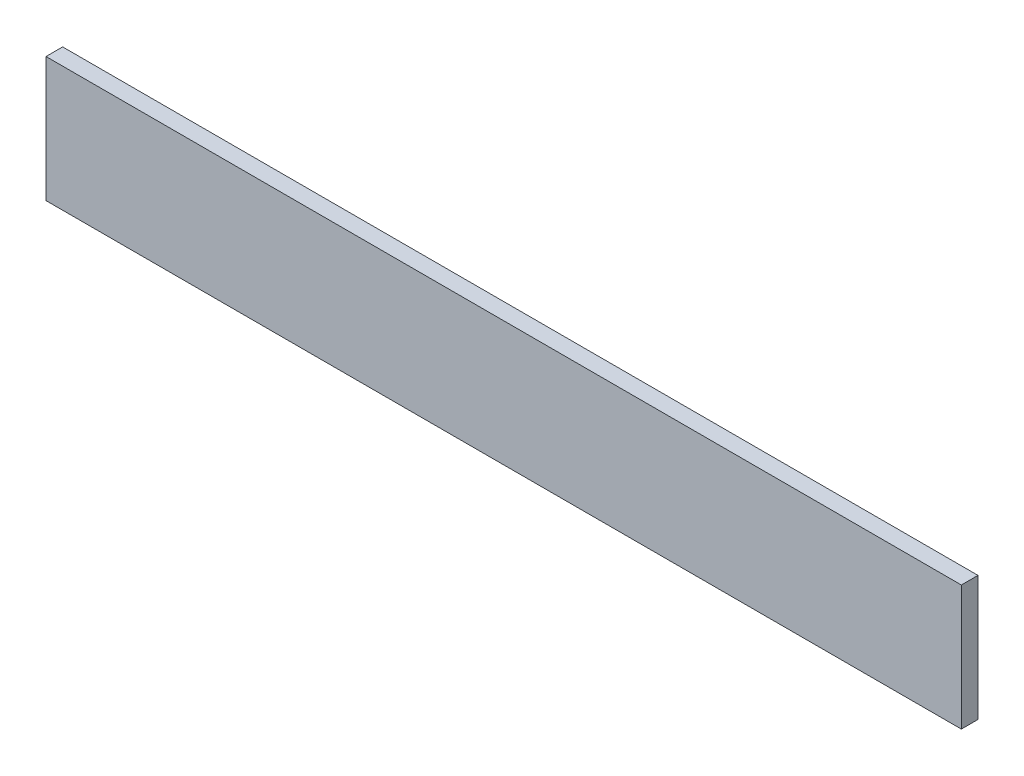
from build123d import *

# Parameters (mm, degrees)
CROQUIS1_W              = 220
CROQUIS1_H              = 30
SALIENTE_EXTRUIR1_DEPTH = 4


with BuildPart() as part:
    # Croquis1 → Saliente-Extruir1 (new body)
    with BuildSketch(Plane.XY):
        with Locations((110, -15)):
            Rectangle(CROQUIS1_W, CROQUIS1_H)
    extrude(amount=SALIENTE_EXTRUIR1_DEPTH)


solid = part.part
